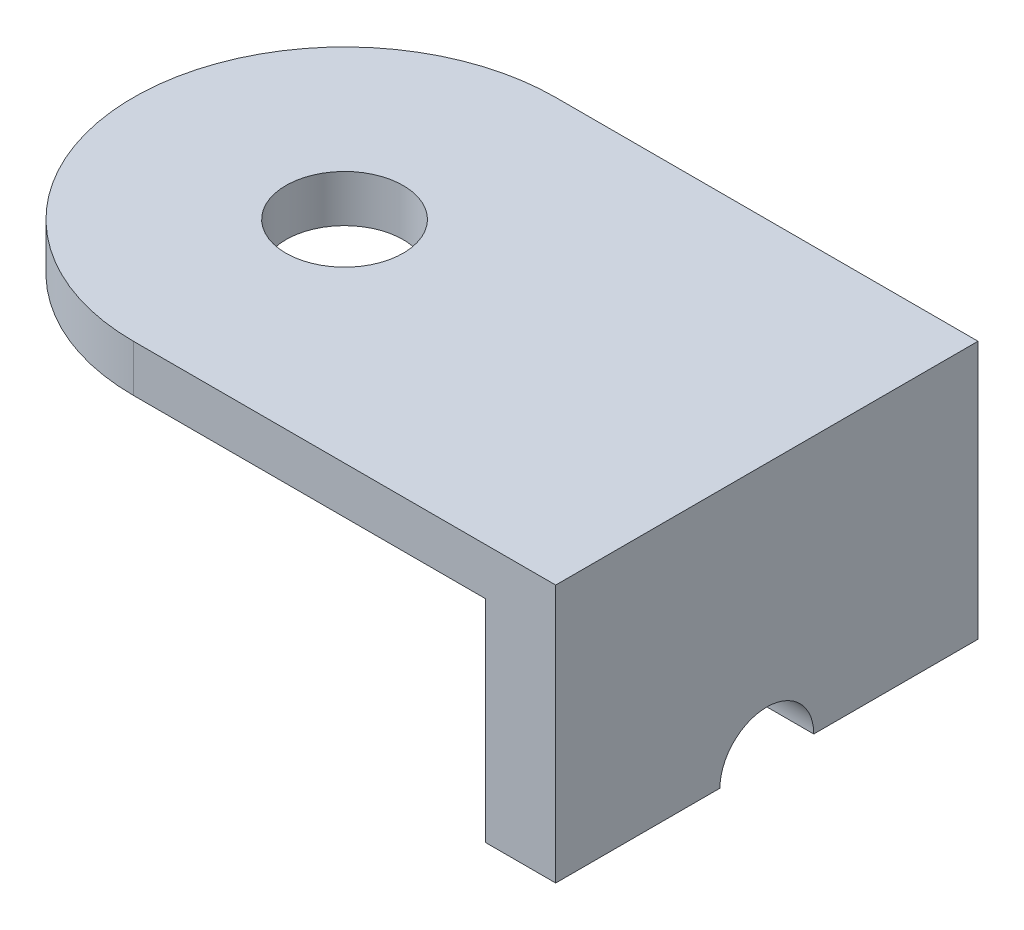
from build123d import *

# Parameters (mm, degrees)
SKETCH1_R           = 2.5
BOSS_EXTRUDE1_DEPTH = 2
BOSS_EXTRUDE2_DEPTH = 3


with BuildPart() as part:
    # Sketch1 → Boss-Extrude1 (new body)
    with BuildSketch(Plane(origin=(0, 0, 0), x_dir=(1, 0, 0), z_dir=(0, 1, 0))):
        with BuildLine():
            Line((0, 9), (18, 9))
            Line((18, 9), (18, -9))
            Line((18, -9), (0, -9))
            ThreePointArc((0, -9), (-9, 0), (0, 9))
        make_face()
        with Locations(Location((0, 0, 0), (0, 0, 270))):
            Circle(SKETCH1_R, mode=Mode.SUBTRACT)
    extrude(amount=BOSS_EXTRUDE1_DEPTH)

    # Sketch2 → Boss-Extrude2 (add)
    with BuildSketch(Plane(origin=(18, 0, 0), x_dir=(0, 0, -1), z_dir=(1, 0, 0))):
        with BuildLine():
            Line((9, 0), (-9, 0))
            Line((-9, 0), (-9, -9))
            Line((-9, -9), (-2, -9))
            ThreePointArc((-2, -9), (0, -7), (2, -9))
            Line((2, -9), (9, -9))
            Line((9, -9), (9, 0))
        make_face()
    extrude(amount=-BOSS_EXTRUDE2_DEPTH)


solid = part.part
